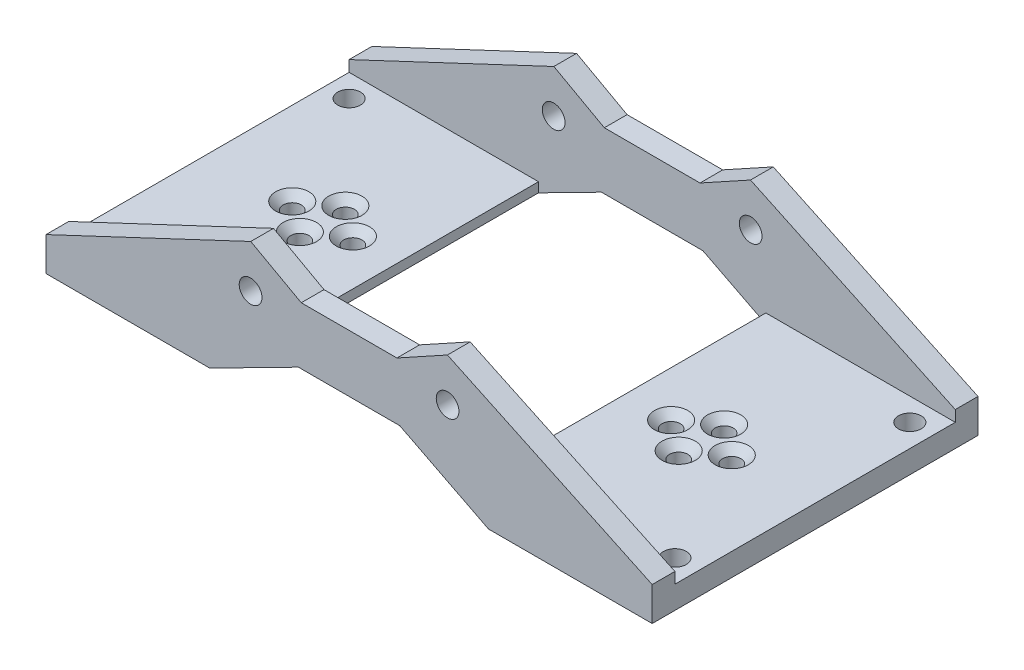
from build123d import *

# Parameters (mm, degrees)
SKETCH6_R                                    = 1.5
BOSS_EXTRUDE4_DEPTH                          = 21.5
SKETCH7_W                                    = 80
SKETCH7_H                                    = 18.040160632
SKETCH7_W_2                                  = 30
SKETCH7_H_2                                  = 6
CUT_EXTRUDE3_DEPTH                           = 18.5
CSK_FOR_M2_COUNTERSUNK_FLAT_HEAD_SCR_2_COUNT = 2
CSK_FOR_M2_COUNTERSUNK_FLAT_HEAD_SCR_2_PITCH = 5
CSK_FOR_M2_COUNTERSUNK_FLAT_HEAD_SCR_3_COUNT = 2
CSK_FOR_M2_COUNTERSUNK_FLAT_HEAD_SCR_3_PITCH = 6
CSK_FOR_M2_COUNTERSUNK_FLAT_HEAD_SCR_4_COUNT = 2
CSK_FOR_M2_COUNTERSUNK_FLAT_HEAD_SCR_4_PITCH = 5
SKETCH90_R                                   = 1.5
CUT_EXTRUDE4_DEPTH                           = 48.575091013


with BuildPart() as part:
    # Sketch6 → Boss-Extrude4 (new, symmetric)
    with BuildSketch(Plane.XY):
        Polygon((-31, 93.5), (-19, 93.5), (-18.392575962, 93.5), (-6.688348482, 99.45725361), (6.688348482, 99.45725361), (18.392575962, 93.5), (19, 93.5), (31, 93.5), (40, 93.5), (40, 97.959320893), (12.976127248, 110.682358229), (6.31198523, 107.009209086), (-6.31198523, 107.009209086), (-12.976127248, 110.682358229), (-40, 97.959320893), (-40, 93.5), align=None)
        with Locations((-13, 105)):
            Circle(SKETCH6_R, mode=Mode.SUBTRACT)
        with Locations(Location((13, 105, 0), (0, 0, 180))):
            Circle(SKETCH6_R, mode=Mode.SUBTRACT)
    extrude(amount=BOSS_EXTRUDE4_DEPTH, both=True)

    # Sketch7 → Cut-Extrude3 (cut, symmetric)
    with BuildSketch(Plane.XY):
        with Locations((0, 105.520080316)):
            Rectangle(SKETCH7_W, SKETCH7_H)
        with Locations((0, 93.5)):
            Rectangle(SKETCH7_W_2, SKETCH7_H_2)
    extrude(amount=CUT_EXTRUDE3_DEPTH, both=True, mode=Mode.SUBTRACT)

    # Sketch89 → CSK for M2 Countersunk Flat Head Screw1 (revolve, cut)
    with BuildSketch(Plane(origin=(-25, 96.5, -3), x_dir=(0, 0, 1), z_dir=(1, 0, 0))):
        Polygon((0, 0), (0, 8.221032743), (1.2, 7.5), (1.2, 1), (2.2, 0), align=None)
    csk_for_m2_countersunk_flat_head_screw1 = revolve(axis=Axis((-25, 102.85, -3), (0, -1, 0)), mode=Mode.SUBTRACT)

    # CSK for M2 Countersunk Flat Head Scr 2: CSK for M2 Countersunk Flat Head Screw1 ×2
    with Locations(*[Vector(0.7999999999999998, 0, 0.6000000000000002) * (i * CSK_FOR_M2_COUNTERSUNK_FLAT_HEAD_SCR_2_PITCH) for i in range(1, CSK_FOR_M2_COUNTERSUNK_FLAT_HEAD_SCR_2_COUNT)]):
        add(csk_for_m2_countersunk_flat_head_screw1, mode=Mode.SUBTRACT)

    # CSK for M2 Countersunk Flat Head Scr 3: CSK for M2 Countersunk Flat Head Screw1 ×2
    with Locations(*[(0, 0, i * CSK_FOR_M2_COUNTERSUNK_FLAT_HEAD_SCR_3_PITCH) for i in range(1, CSK_FOR_M2_COUNTERSUNK_FLAT_HEAD_SCR_3_COUNT)]):
        add(csk_for_m2_countersunk_flat_head_screw1, mode=Mode.SUBTRACT)

    # CSK for M2 Countersunk Flat Head Scr 4: CSK for M2 Countersunk Flat Head Screw1 ×2
    with Locations(*[Vector(-0.8000000000000003, 0, 0.5999999999999996) * (i * CSK_FOR_M2_COUNTERSUNK_FLAT_HEAD_SCR_4_PITCH) for i in range(1, CSK_FOR_M2_COUNTERSUNK_FLAT_HEAD_SCR_4_COUNT)]):
        add(csk_for_m2_countersunk_flat_head_screw1, mode=Mode.SUBTRACT)

    # Mirror1: CSK for M2 Countersunk Flat Head Screw1 across plane
    add(csk_for_m2_countersunk_flat_head_screw1.mirror(Plane(origin=(0, 0, 0), x_dir=(0, 0, 1), z_dir=(1, 0, 0))), mode=Mode.SUBTRACT)

    # Mirror1 copy 1 sketch → Mirror1 copy 1 (revolve, cut)
    with BuildSketch(Plane(origin=(21, 96.5, 0), x_dir=(0, 0, 1), z_dir=(-1, 0, 0))):
        Polygon((0, 0), (0, -8.221032743), (1.2, -7.5), (1.2, -1), (2.2, 0), align=None)
    revolve(axis=Axis((21, 102.85, 0), (0, 1, 0)), mode=Mode.SUBTRACT)

    # Mirror1 copy 2 sketch → Mirror1 copy 2 (revolve, cut)
    with BuildSketch(Plane(origin=(25, 96.5, 3), x_dir=(0, 0, 1), z_dir=(-1, 0, 0))):
        Polygon((0, 0), (0, -8.221032743), (1.2, -7.5), (1.2, -1), (2.2, 0), align=None)
    revolve(axis=Axis((25, 102.85, 3), (0, 1, 0)), mode=Mode.SUBTRACT)

    # Mirror1 copy 3 sketch → Mirror1 copy 3 (revolve, cut)
    with BuildSketch(Plane(origin=(29, 96.5, 0), x_dir=(0, 0, 1), z_dir=(-1, 0, 0))):
        Polygon((0, 0), (0, -8.221032743), (1.2, -7.5), (1.2, -1), (2.2, 0), align=None)
    revolve(axis=Axis((29, 102.85, 0), (0, 1, 0)), mode=Mode.SUBTRACT)

    # Sketch90 → Cut-Extrude4 (cut, through all)
    with BuildSketch(Plane(origin=(0, 96.5, 0), x_dir=(1, 0, 0), z_dir=(0, 1, 0))):
        with Locations(Location((-37, 15.5, 0), (0, 0, 270))):
            Circle(SKETCH90_R)
        with Locations(Location((-37, -15.5, 0), (0, 0, 270))):
            Circle(SKETCH90_R)
        with Locations(Location((37, 15.5, 0), (0, 0, 270))):
            Circle(SKETCH90_R)
        with Locations(Location((37, -15.5, 0), (0, 0, 270))):
            Circle(SKETCH90_R)
    extrude(amount=-CUT_EXTRUDE4_DEPTH, mode=Mode.SUBTRACT)


solid = part.part
